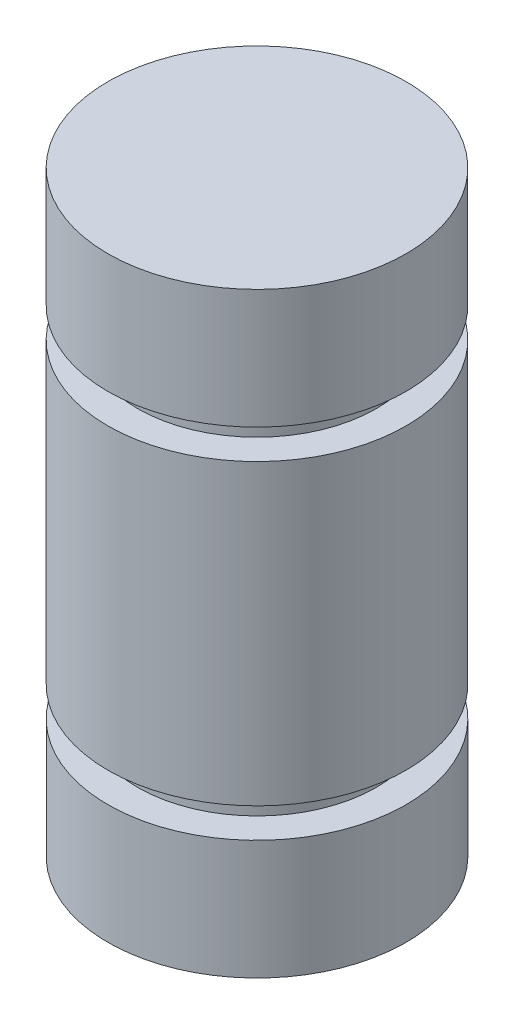
from build123d import *

# Parameters (mm, degrees)
SKETCH1_R           = 6.35
BOSS_EXTRUDE2_DEPTH = 12.7
SKETCH4_R           = 5.08
BOSS_EXTRUDE3_DEPTH = 1.27
SKETCH5_R           = 6.35
BOSS_EXTRUDE4_DEPTH = 5.08
BOSS_EXTRUDE5_START = 1.27
SKETCH6_R           = 5.08
BOSS_EXTRUDE5_DEPTH = 1.27
BOSS_EXTRUDE6_START = 5.08
SKETCH7_R           = 6.35
BOSS_EXTRUDE6_DEPTH = 5.08


with BuildPart() as part:
    # Sketch1 → Boss-Extrude2 (new body)
    with BuildSketch(Plane(origin=(0, 0, 0), x_dir=(1, 0, 0), z_dir=(0, 1, 0))):
        with Locations(Location((0, 0, 0), (0, 0, 270))):
            Circle(SKETCH1_R)
    extrude(amount=BOSS_EXTRUDE2_DEPTH)

    # Sketch4 → Boss-Extrude3 (add)
    with BuildSketch(Plane(origin=(0, 12.7, 0), x_dir=(1, 0, 0), z_dir=(0, 1, 0))):
        with Locations(Location((0, 0, 0), (0, 0, 270))):
            Circle(SKETCH4_R)
    extrude(amount=BOSS_EXTRUDE3_DEPTH)

    # Sketch5 → Boss-Extrude4 (add)
    with BuildSketch(Plane(origin=(0, 13.97, 0), x_dir=(1, 0, 0), z_dir=(0, 1, 0))):
        with Locations(Location((0, 0, 0), (0, 0, 270))):
            Circle(SKETCH5_R)
    extrude(amount=BOSS_EXTRUDE4_DEPTH)

    # Sketch6 → Boss-Extrude5 (add)
    with BuildSketch(Plane.XZ.offset(BOSS_EXTRUDE5_START)):
        with Locations(Location((0, 0, 0), (0, 0, 90))):
            Circle(SKETCH6_R)
    extrude(amount=-BOSS_EXTRUDE5_DEPTH)

    # Sketch7 → Boss-Extrude6 (add)
    with BuildSketch(Plane.XZ.offset(1.27).offset(BOSS_EXTRUDE6_START)):
        with Locations(Location((0, 0, 0), (0, 0, 90))):
            Circle(SKETCH7_R)
    extrude(amount=-BOSS_EXTRUDE6_DEPTH)


solid = part.part
